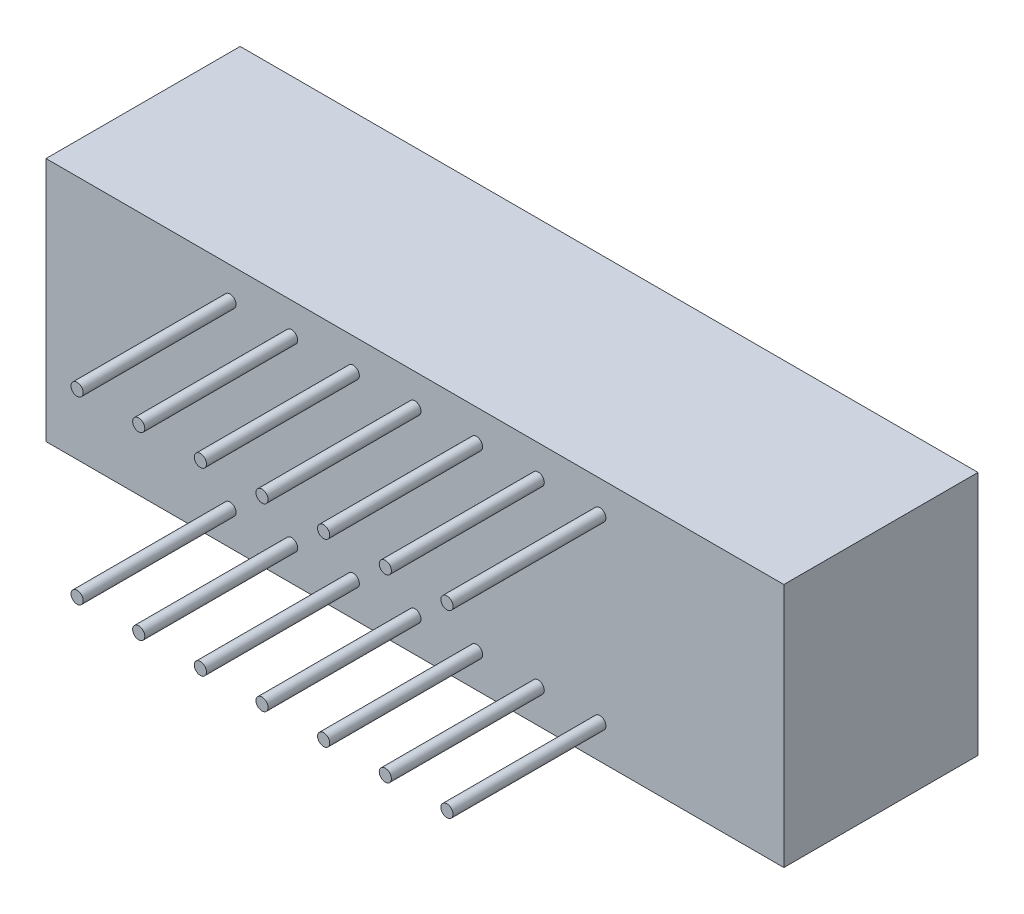
from build123d import *

# Parameters (mm, degrees)
SKETCH2_W           = 30.4
SKETCH2_H           = 10.1
BOSS_EXTRUDE1_DEPTH = 8
SKETCH3_R           = 0.25
BOSS_EXTRUDE2_DEPTH = 6.3


with BuildPart() as part:
    # Sketch2 → Boss-Extrude1 (new body)
    with BuildSketch(Plane.XY):
        with Locations((15.2, 5.05)):
            Rectangle(SKETCH2_W, SKETCH2_H)
    extrude(amount=BOSS_EXTRUDE1_DEPTH)

    # Sketch3 → Boss-Extrude2 (add)
    with BuildSketch(Plane.XY.offset(8)):
        with Locations(Location((7.58, 8.805, 0), (0, 0, 180))):
            Circle(SKETCH3_R)
        with Locations(Location((10.12, 8.805, 0), (0, 0, 180))):
            Circle(SKETCH3_R)
        with Locations(Location((12.66, 8.805, 0), (0, 0, 180))):
            Circle(SKETCH3_R)
        with Locations(Location((15.2, 8.805, 0), (0, 0, 180))):
            Circle(SKETCH3_R)
        with Locations(Location((17.74, 8.805, 0), (0, 0, 180))):
            Circle(SKETCH3_R)
        with Locations(Location((20.28, 8.805, 0), (0, 0, 180))):
            Circle(SKETCH3_R)
        with Locations(Location((22.82, 8.805, 0), (0, 0, 180))):
            Circle(SKETCH3_R)
        with Locations(Location((10.12, 1.385, 0), (0, 0, 180))):
            Circle(SKETCH3_R)
        with Locations(Location((12.66, 1.385, 0), (0, 0, 180))):
            Circle(SKETCH3_R)
        with Locations(Location((15.2, 1.385, 0), (0, 0, 180))):
            Circle(SKETCH3_R)
        with Locations(Location((17.74, 1.385, 0), (0, 0, 180))):
            Circle(SKETCH3_R)
        with Locations(Location((20.28, 1.385, 0), (0, 0, 180))):
            Circle(SKETCH3_R)
        with Locations(Location((22.82, 1.385, 0), (0, 0, 180))):
            Circle(SKETCH3_R)
        with Locations(Location((7.58, 1.385, 0), (0, 0, 180))):
            Circle(SKETCH3_R)
    extrude(amount=BOSS_EXTRUDE2_DEPTH)


solid = part.part
